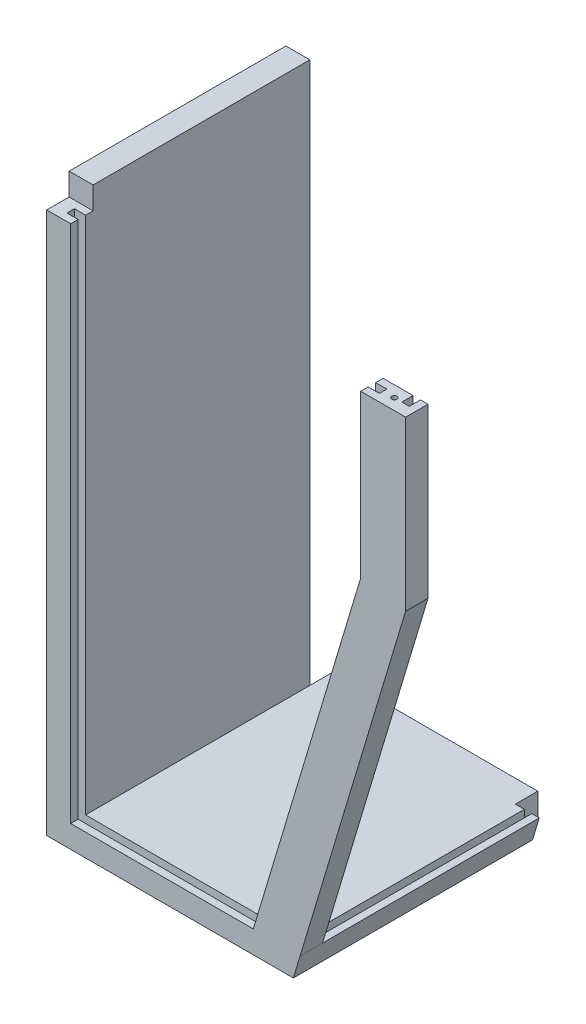
from build123d import *

# Parameters (mm, degrees)
SKETCH_1_W          = 120
SKETCH_1_H          = 32
EXTRUDE_1_DEPTH     = 3
CUT_EXTRUDE_1_DEPTH = 69.066144301
SKETCH_2_3_W        = 27.5
SKETCH_2_3_H        = 3
EXTRUDE_2_DEPTH     = 3
SKETCH_3_W          = 3.2
SKETCH_3_H          = 32
EXTRUDE_3_DEPTH     = 72.5
EXTRUDE_4_DEPTH     = 3
SKETCH_5_W          = 3
SKETCH_5_H          = 3
CUT_EXTRUDE_2_DEPTH = 90.831181838
SKETCH_6_W          = 24.435270894
SKETCH_6_H          = 1
SKETCH_6_W_2        = 1
SKETCH_6_H_2        = 29
CUT_EXTRUDE_3_DEPTH = 1.5
SKETCH_7_W          = 1
SKETCH_7_H          = 71
CUT_EXTRUDE_4_DEPTH = 1.5
CUT_EXTRUDE_6_REACH = 91.831
SKETCH_7_5_W        = 1
SKETCH_7_5_H        = 22.499258378
CUT_EXTRUDE_7_DEPTH = 40.31507816
CUT_EXTRUDE_8_DEPTH = 1.5
SKETCH_10_R         = 0.35
CUT_EXTRUDE_9_DEPTH = 3


with BuildPart() as part:
    # 草图1 → 凸台-拉伸1 (new body)
    with BuildSketch(Plane(origin=(0, 0, 0), x_dir=(1, 0, 0), z_dir=(0, 1, 0))):
        Rectangle(SKETCH_1_W, SKETCH_1_H)
    extrude(amount=EXTRUDE_1_DEPTH)

    # 草图2 → 切除-拉伸1 (cut, through all)
    with BuildSketch(Plane(origin=(0, 0, -16), x_dir=(-1, 0, 0), z_dir=(0, 0, -1))):
        Polygon((-60, 0), (27, 0), (26.1, 3), (-60, 3), align=None)
    extrude(amount=-CUT_EXTRUDE_1_DEPTH, mode=Mode.SUBTRACT)

    # 草图2<3> → 凸台-拉伸2 (add)
    with BuildSketch(Plane(origin=(0, 0, -16), x_dir=(-1, 0, 0), z_dir=(0, 0, -1))):
        with Locations((43.05, 1.5)):
            Rectangle(SKETCH_2_3_W, SKETCH_2_3_H)
    extrude(amount=EXTRUDE_2_DEPTH)

    # 草图3 → 凸台-拉伸3 (add)
    with BuildSketch(Plane(origin=(0, 3, 0), x_dir=(1, 0, 0), z_dir=(0, 1, 0))):
        with Locations((-58.4, 0)):
            Rectangle(SKETCH_3_W, SKETCH_3_H)
    extrude(amount=EXTRUDE_3_DEPTH)

    # 草图4 → 凸台-拉伸4 (add)
    with BuildSketch(Plane.XY.offset(16)):
        Polygon((-11.98492184, 50.000741622), (-11.98492184, 72.5), (-17.98492184, 72.5), (-17.98492184, 50.882243247), (-32.364729106, 3), (-26.1, 3), align=None)
    extrude(amount=-EXTRUDE_4_DEPTH)

    # 草图5 → 切除-拉伸2 (cut, through all)
    with BuildSketch(Plane(origin=(-56.8, 0, 0), x_dir=(0, 0, -1), z_dir=(1, 0, 0))):
        with Locations((-14.5, 74)):
            Rectangle(SKETCH_5_W, SKETCH_5_H)
    extrude(amount=-CUT_EXTRUDE_2_DEPTH, mode=Mode.SUBTRACT)

    # 草图6 → 切除-拉伸3 (cut)
    with BuildSketch(Plane(origin=(0, 3, 0), x_dir=(1, 0, 0), z_dir=(0, 1, 0))):
        with Locations((-44.582364553, -14.5)):
            Rectangle(SKETCH_6_W, SKETCH_6_H)
        with Locations((-27.6, 1.5)):
            Rectangle(SKETCH_6_W_2, SKETCH_6_H_2)
    extrude(amount=-CUT_EXTRUDE_3_DEPTH, mode=Mode.SUBTRACT)

    # 草图7 → 切除-拉伸4 (cut)
    with BuildSketch(Plane(origin=(-56.8, 0, 0), x_dir=(0, 0, -1), z_dir=(1, 0, 0))):
        with Locations((-14.5, 37)):
            Rectangle(SKETCH_7_W, SKETCH_7_H)
    extrude(amount=-CUT_EXTRUDE_4_DEPTH, mode=Mode.SUBTRACT)

    # 切除-拉伸6: up to this plane
    cut_extrude_6_end = Plane(origin=(-29.077043909, 8.732303646, 13), z_dir=(0.9577429283961915, -0.2876255953615531, 0))
    # 草图7<4> → 切除-拉伸6 (cut, up to the surface)
    with BuildSketch(Plane(origin=(-56.8, 0, 0), x_dir=(0, 0, -1), z_dir=(1, 0, 0)), mode=Mode.PRIVATE) as cut_extrude_6_sk1:
        Polygon((-15, 3), (-15, 1.5), (-14, 1.5), (-14, 3), (-14, 50.000741622), (-15, 50.000741622), align=None)
    cut_extrude_6_tool1 = split(extrude(cut_extrude_6_sk1.sketch, amount=CUT_EXTRUDE_6_REACH, mode=Mode.PRIVATE), bisect_by=cut_extrude_6_end, keep=Keep.BOTH, mode=Mode.PRIVATE)
    add(cut_extrude_6_tool1.solids().sort_by_distance((-56.8, 25.750371, 14.5))[0], mode=Mode.SUBTRACT)

    # 草图7<5> → 切除-拉伸7 (cut)
    with BuildSketch(Plane(origin=(-56.8, 0, 0), x_dir=(0, 0, -1), z_dir=(1, 0, 0))):
        with Locations((-14.5, 61.250370811)):
            Rectangle(SKETCH_7_5_W, SKETCH_7_5_H)
    extrude(amount=CUT_EXTRUDE_7_DEPTH, mode=Mode.SUBTRACT)

    # 草图9 → 切除-拉伸8 (cut)
    with BuildSketch(Plane(origin=(0, 0, 13), x_dir=(-1, 0, 0), z_dir=(0, 0, -1))):
        Polygon((28.1, 1.5), (27.1, 1.5), (27.1, 3), (12.98492184, 50.000741622), (12.98492184, 72.5), (13.98492184, 72.5), (13.98492184, 50.000741622), (28.1, 3), align=None)
    extrude(amount=-CUT_EXTRUDE_8_DEPTH, mode=Mode.SUBTRACT)

    # 草图10 → 切除-拉伸9 (cut)
    with BuildSketch(Plane(origin=(0, 72.5, 0), x_dir=(1, 0, 0), z_dir=(0, 1, 0))):
        with Locations(Location((-14.98492184, -14.5, 0), (0, 0, 270))):
            Circle(SKETCH_10_R)
    extrude(amount=-CUT_EXTRUDE_9_DEPTH, mode=Mode.SUBTRACT)


solid = part.part
